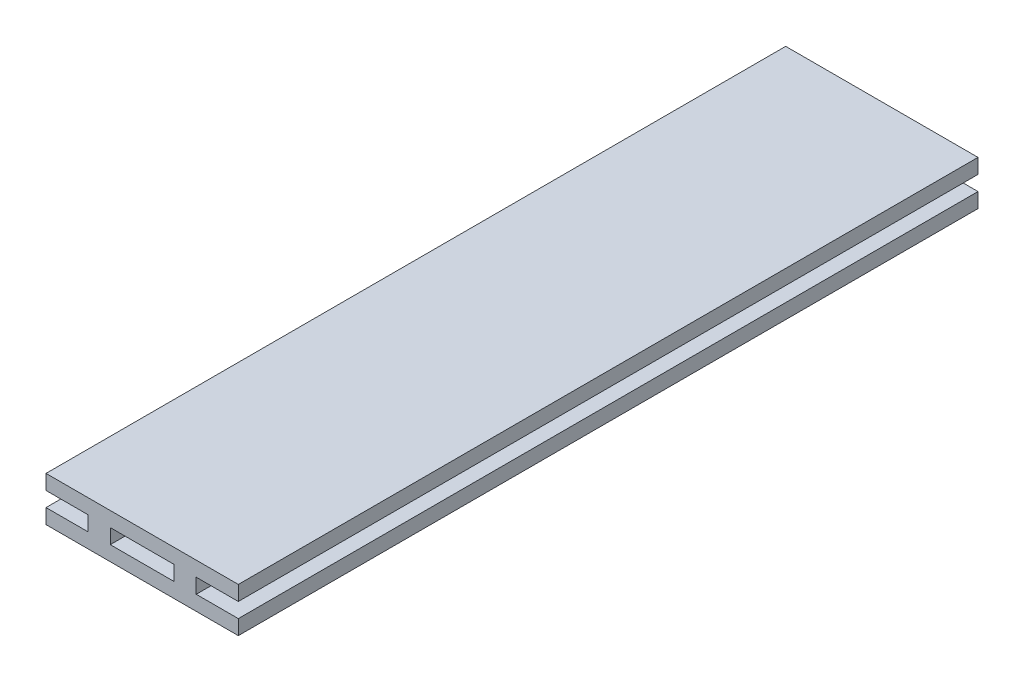
from build123d import *

# Parameters (mm, degrees)
SKETCH2_W           = 8.622341868
SKETCH2_H           = 2
BOSS_EXTRUDE1_DEPTH = 100


with BuildPart() as part:
    # Sketch2 → Boss-Extrude1 (new body)
    with BuildSketch(Plane.XY):
        Polygon((13, 3), (-13, 3), (-13, 1), (-7.311170934, 1), (-7.311170934, -1), (-13, -1), (-13, -3), (13, -3), (13, -1), (7.311170934, -1), (7.311170934, 1), (13, 1), align=None)
        Rectangle(SKETCH2_W, SKETCH2_H, mode=Mode.SUBTRACT)
    extrude(amount=BOSS_EXTRUDE1_DEPTH)


solid = part.part
